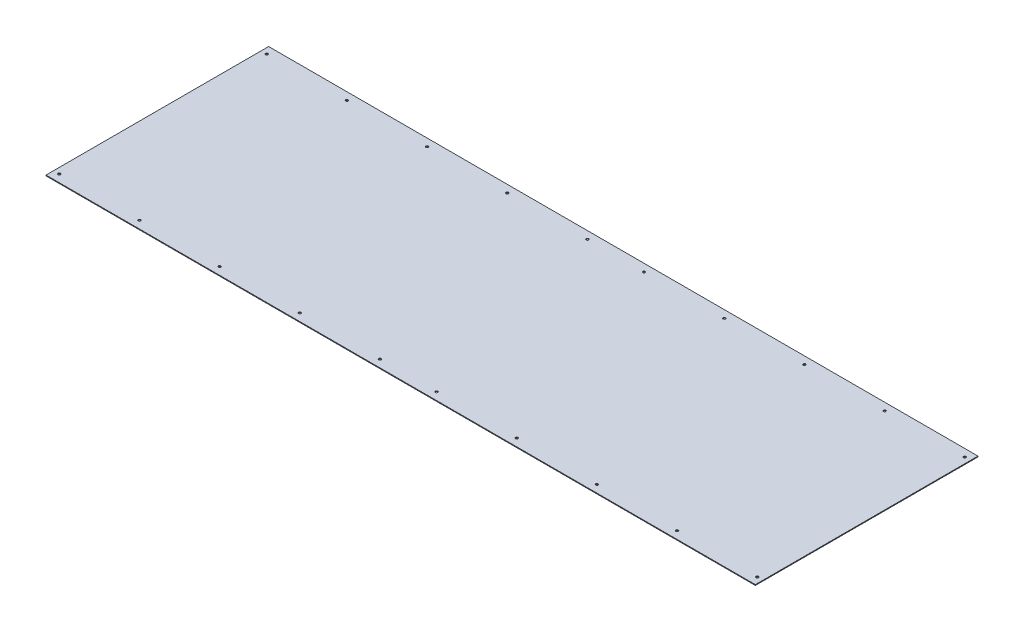
from build123d import *

# Parameters (mm, degrees)
SKETCH1_W           = 1880
SKETCH1_H           = 590
BOSS_EXTRUDE1_DEPTH = 2
SKETCH3_R           = 3.25
CUT_EXTRUDE1_DEPTH  = 10


with BuildPart() as part:
    # Sketch1 → Boss-Extrude1 (new body)
    with BuildSketch(Plane(origin=(0, 0, 0), x_dir=(1, 0, 0), z_dir=(0, 1, 0))):
        Rectangle(SKETCH1_W, SKETCH1_H)
    extrude(amount=BOSS_EXTRUDE1_DEPTH)

    # Sketch3 → Cut-Extrude1 (cut)
    with BuildSketch(Plane(origin=(0, 2, 0), x_dir=(1, 0, 0), z_dir=(0, 1, 0))):
        with Locations(Location((-925, 275, 0), (0, 0, 270))):
            Circle(SKETCH3_R)
        with Locations(Location((-925, -275, 0), (0, 0, 270))):
            Circle(SKETCH3_R)
        with Locations(Location((-712.5, 275, 0), (0, 0, 270))):
            Circle(SKETCH3_R)
        with Locations(Location((-712.5, -275, 0), (0, 0, 270))):
            Circle(SKETCH3_R)
        with Locations(Location((-500, 275, 0), (0, 0, 270))):
            Circle(SKETCH3_R)
        with Locations(Location((-500, -275, 0), (0, 0, 270))):
            Circle(SKETCH3_R)
        with Locations(Location((-287.5, 275, 0), (0, 0, 270))):
            Circle(SKETCH3_R)
        with Locations(Location((-287.5, -275, 0), (0, 0, 270))):
            Circle(SKETCH3_R)
        with Locations(Location((-75, 275, 0), (0, 0, 270))):
            Circle(SKETCH3_R)
        with Locations(Location((-75, -275, 0), (0, 0, 270))):
            Circle(SKETCH3_R)
        with Locations(Location((925, 275, 0), (0, 0, 270))):
            Circle(SKETCH3_R)
        with Locations(Location((925, -275, 0), (0, 0, 270))):
            Circle(SKETCH3_R)
        with Locations(Location((712.5, 275, 0), (0, 0, 270))):
            Circle(SKETCH3_R)
        with Locations(Location((712.5, -275, 0), (0, 0, 270))):
            Circle(SKETCH3_R)
        with Locations(Location((500, 275, 0), (0, 0, 270))):
            Circle(SKETCH3_R)
        with Locations(Location((500, -275, 0), (0, 0, 270))):
            Circle(SKETCH3_R)
        with Locations(Location((287.5, 275, 0), (0, 0, 270))):
            Circle(SKETCH3_R)
        with Locations(Location((287.5, -275, 0), (0, 0, 270))):
            Circle(SKETCH3_R)
        with Locations(Location((75, 275, 0), (0, 0, 270))):
            Circle(SKETCH3_R)
        with Locations(Location((75, -275, 0), (0, 0, 270))):
            Circle(SKETCH3_R)
    extrude(amount=-CUT_EXTRUDE1_DEPTH, mode=Mode.SUBTRACT)


solid = part.part
